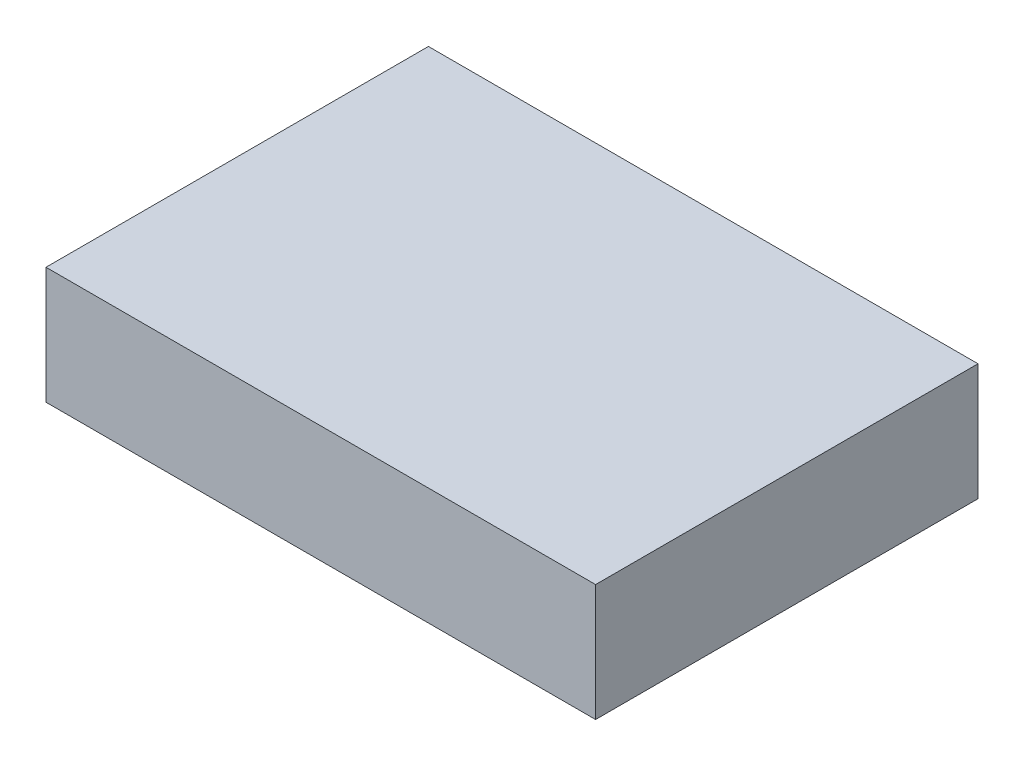
from build123d import *

# Parameters (mm, degrees)
SKIZZE1_W                       = 503
SKIZZE1_H                       = 107
AUFSATZ_LINEAR_AUSTRAGEN1_DEPTH = 350
SKIZZE2_R                       = 19
AUFSATZ_LINEAR_AUSTRAGEN2_DEPTH = 25


with BuildPart() as part:
    # Skizze1 → Aufsatz-Linear austragen1 (new body)
    with BuildSketch(Plane.XY):
        with Locations((251.5, 53.5)):
            Rectangle(SKIZZE1_W, SKIZZE1_H)
    extrude(amount=AUFSATZ_LINEAR_AUSTRAGEN1_DEPTH)

    # Skizze2 → Aufsatz-Linear austragen2 (add)
    with BuildSketch(Plane.XZ):
        with Locations(Location((84.399565915, 294.555551984, 0), (0, 0, 90))):
            Circle(SKIZZE2_R)
        with Locations(Location((403.747062166, 294.555551984, 0), (0, 0, 90))):
            Circle(SKIZZE2_R)
        with Locations(Location((403.747062166, 75.47123017, 0), (0, 0, 90))):
            Circle(SKIZZE2_R)
        with Locations(Location((84.399565915, 75.47123017, 0), (0, 0, 90))):
            Circle(SKIZZE2_R)
    extrude(amount=AUFSATZ_LINEAR_AUSTRAGEN2_DEPTH)


solid = part.part
